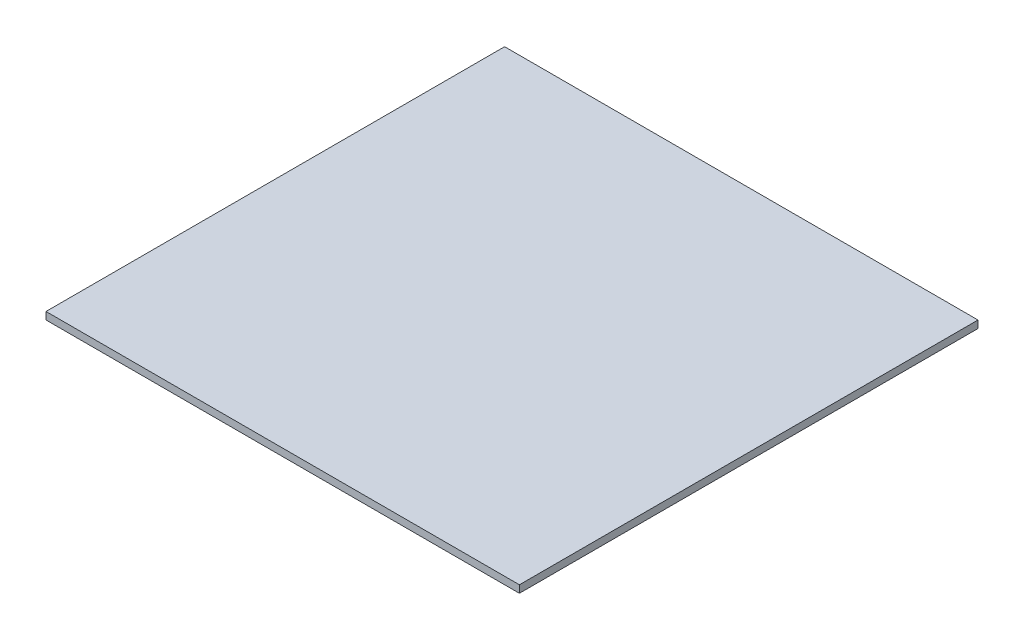
from build123d import *

# Parameters (mm, degrees)
SKETCH2_W           = 203.2
SKETCH2_H           = 196.85
BOSS_EXTRUDE1_DEPTH = 3.175


with BuildPart() as part:
    # Sketch2 → Boss-Extrude1 (new body)
    with BuildSketch(Plane(origin=(0, 0, 0), x_dir=(1, 0, 0), z_dir=(0, 1, 0))):
        Rectangle(SKETCH2_W, SKETCH2_H)
    extrude(amount=BOSS_EXTRUDE1_DEPTH)


solid = part.part
